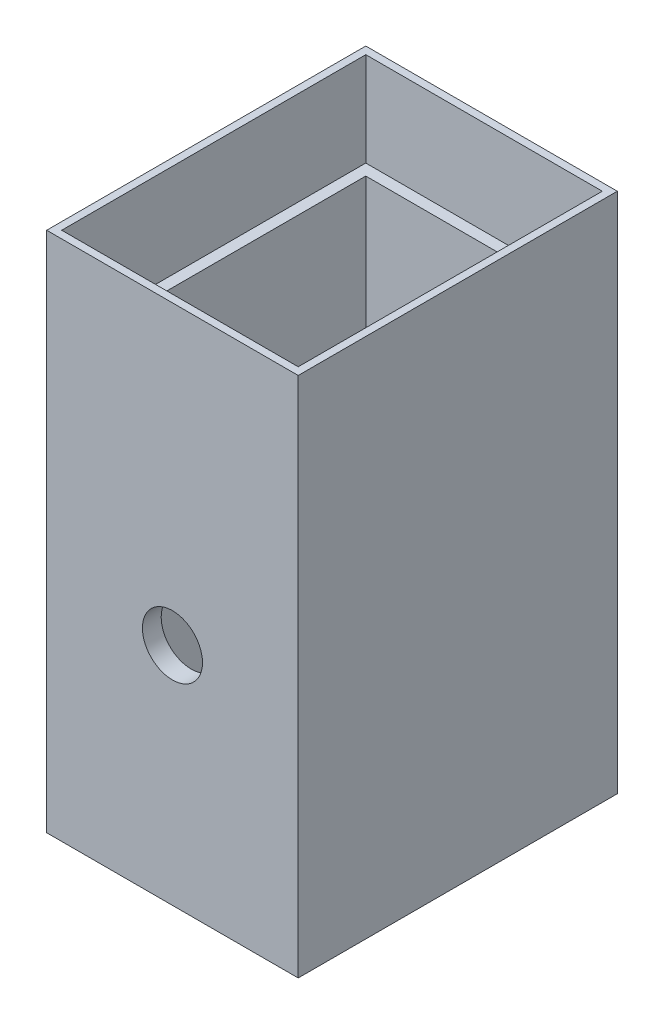
from build123d import *

# Parameters (mm, degrees)
SKETCH2_W           = 67
SKETCH2_H           = 85
BOSS_EXTRUDE1_DEPTH = 4
SKETCH2_3_W         = 67
SKETCH2_3_H         = 85
SKETCH2_3_W_2       = 57
SKETCH2_3_H_2       = 75
BOSS_EXTRUDE2_DEPTH = 114
SKETCH4_W           = 67
SKETCH4_H           = 85
SKETCH4_W_2         = 63
SKETCH4_H_2         = 81
BOSS_EXTRUDE3_DEPTH = 25
SKETCH6_R           = 8
CUT_EXTRUDE1_DEPTH  = 25
SKETCH5_W           = 10
SKETCH5_H           = 15
CUT_EXTRUDE2_DEPTH  = 25


with BuildPart() as part:
    # Sketch2 → Boss-Extrude1 (new body)
    with BuildSketch(Plane(origin=(0, 0, 0), x_dir=(1, 0, 0), z_dir=(0, 1, 0))):
        Rectangle(SKETCH2_W, SKETCH2_H)
    extrude(amount=BOSS_EXTRUDE1_DEPTH)

    # Sketch2<3> → Boss-Extrude2 (add)
    with BuildSketch(Plane(origin=(0, 0, 0), x_dir=(1, 0, 0), z_dir=(0, 1, 0))):
        Rectangle(SKETCH2_3_W, SKETCH2_3_H)
        Rectangle(SKETCH2_3_W_2, SKETCH2_3_H_2, mode=Mode.SUBTRACT)
    extrude(amount=BOSS_EXTRUDE2_DEPTH)

    # Sketch4 → Boss-Extrude3 (add)
    with BuildSketch(Plane(origin=(0, 114, 0), x_dir=(1, 0, 0), z_dir=(0, 1, 0))):
        Rectangle(SKETCH4_W, SKETCH4_H)
        Rectangle(SKETCH4_W_2, SKETCH4_H_2, mode=Mode.SUBTRACT)
    extrude(amount=BOSS_EXTRUDE3_DEPTH)

    # Sketch6 → Cut-Extrude1 (cut)
    with BuildSketch(Plane.XY.offset(42.5)):
        with Locations((0, 60)):
            Circle(SKETCH6_R)
    extrude(amount=-CUT_EXTRUDE1_DEPTH, mode=Mode.SUBTRACT)

    # Sketch5 → Cut-Extrude2 (cut)
    with BuildSketch(Plane(origin=(0, 0, -42.5), x_dir=(-1, 0, 0), z_dir=(0, 0, -1))):
        with Locations((18.5, 14.5)):
            Rectangle(SKETCH5_W, SKETCH5_H)
    extrude(amount=-CUT_EXTRUDE2_DEPTH, mode=Mode.SUBTRACT)


solid = part.part
